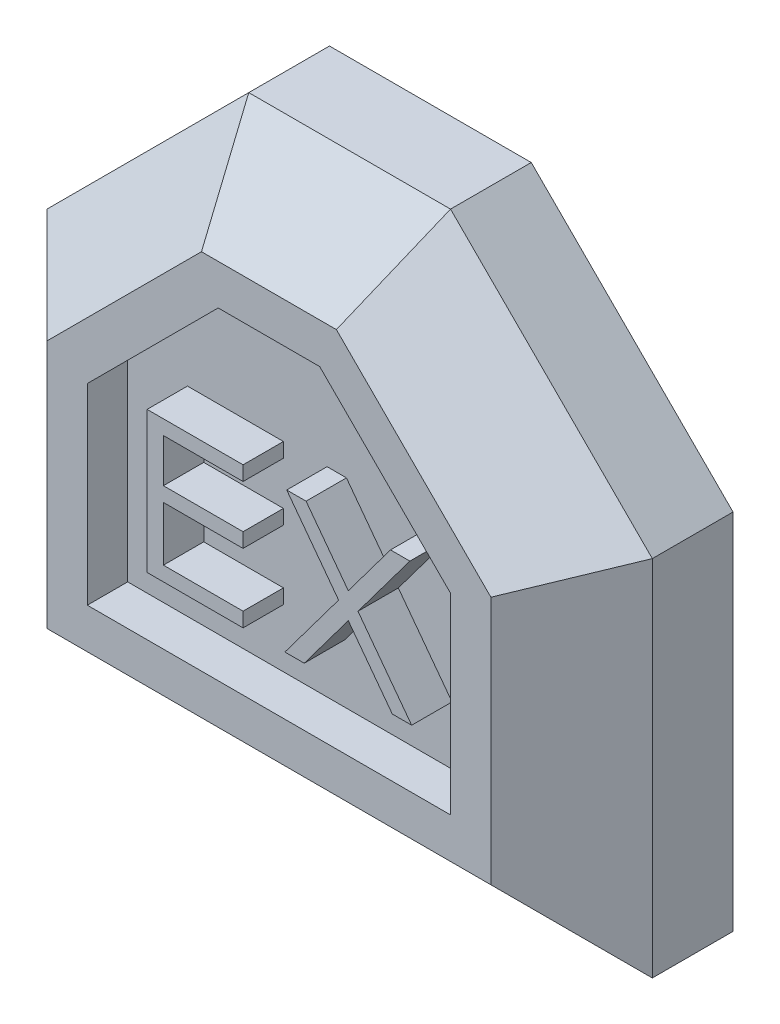
from build123d import *

# Parameters (mm, degrees)
EXTRUDE_1_DEPTH     = 4
CHAMFER_1_SIZE      = 2
CUT_EXTRUDE_1_DEPTH = 1
EXTRUDE_2_DEPTH     = 1


with BuildPart() as part:
    # 草图1 → 凸台-拉伸1 (new body)
    with BuildSketch(Plane.XY):
        Polygon((-7.5, 2), (-2.5, 7), (2.5, 7), (7.5, 2), (7.5, -7), (-7.5, -7), align=None)
    extrude(amount=EXTRUDE_1_DEPTH)

    # 倒角1
    chamfer_1_edges = [part.edges().sort_by_distance(p)[0] for p in [
        (7.5, -2.5, 4),
        (5, 4.5, 4),
        (0, 7, 4),
        (-5, 4.5, 4),
        (-7.5, -2.5, 4),
        (0, -7, 4),
    ]]
    chamfer(chamfer_1_edges, length=CHAMFER_1_SIZE)

    # 草图2 → 切除-拉伸1 (cut)
    with BuildSketch(Plane.XY.offset(4)):
        Polygon((-4.5, -4), (4.5, -4), (4.5, 0.757359313), (1.257359313, 4), (-1.257359313, 4), (-4.5, 0.757359313), align=None)
    extrude(amount=-CUT_EXTRUDE_1_DEPTH, mode=Mode.SUBTRACT)

    # 草图3 → 凸台-拉伸2 (add)
    with BuildSketch(Plane.XY.offset(3)):
        Polygon((-3.018784833, 0.942914113), (-0.640579705, 0.942914113), (-0.640579705, 0.583939754), (-2.614938679, 0.583939754), (-2.614938679, -0.492983323), (-0.640579705, -0.492983323), (-0.640579705, -0.851957682), (-2.614938679, -0.851957682), (-2.614938679, -2.198111528), (-0.640579705, -2.198111528), (-0.640579705, -2.557085887), (-3.018784833, -2.557085887), align=None)
        Polygon((0.440830551, 0.942914113), (0.920397859, 0.942914113), (1.966471577, -0.45652499), (3.012545295, 0.942914113), (3.492112603, 0.942914113), (2.206255231, -0.77693765), (3.536984397, -2.557085887), (3.05741709, -2.557085887), (1.966471577, -1.098051432), (0.875526064, -2.557085887), (0.395958756, -2.557085887), (1.726687923, -0.77693765), align=None)
    extrude(amount=EXTRUDE_2_DEPTH)


solid = part.part
